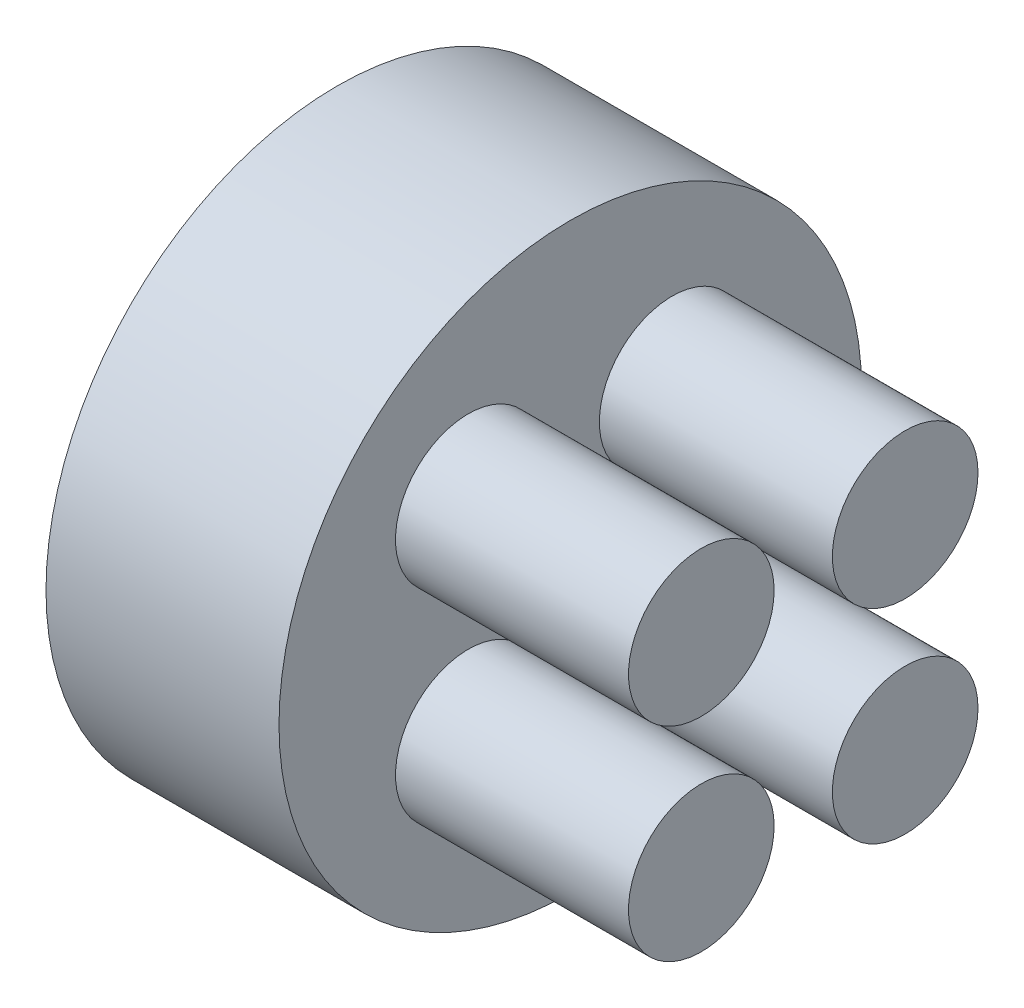
from build123d import *

# Parameters (mm, degrees)
SKETCH_1_R          = 10
EXTRUDE_1_DEPTH     = 8
SKETCH_2_R          = 2.5
EXTRUDE_2_DEPTH     = 8
SKETCH_3_R          = 2.9
CUT_EXTRUDE_1_DEPTH = 3.5


with BuildPart() as part:
    # Эскиз1 → Бобышка-Вытянуть1 (new body)
    with BuildSketch(Plane(origin=(0, 0, 0), x_dir=(0, 0, -1), z_dir=(1, 0, 0))):
        Circle(SKETCH_1_R)
    extrude(amount=EXTRUDE_1_DEPTH)

    # Эскиз2 → Бобышка-Вытянуть2 (add)
    with BuildSketch(Plane(origin=(8, 0, 0), x_dir=(0, 0, -1), z_dir=(1, 0, 0))):
        with Locations((-3.5, 3.5)):
            Circle(SKETCH_2_R)
        with Locations((3.5, 3.5)):
            Circle(SKETCH_2_R)
        with Locations((-3.5, -3.5)):
            Circle(SKETCH_2_R)
        with Locations((3.5, -3.5)):
            Circle(SKETCH_2_R)
    extrude(amount=EXTRUDE_2_DEPTH)

    # Эскиз3 → Вырез-Вытянуть1 (cut)
    with BuildSketch(Plane.ZY):
        Circle(SKETCH_3_R)
    extrude(amount=-CUT_EXTRUDE_1_DEPTH, mode=Mode.SUBTRACT)


solid = part.part
